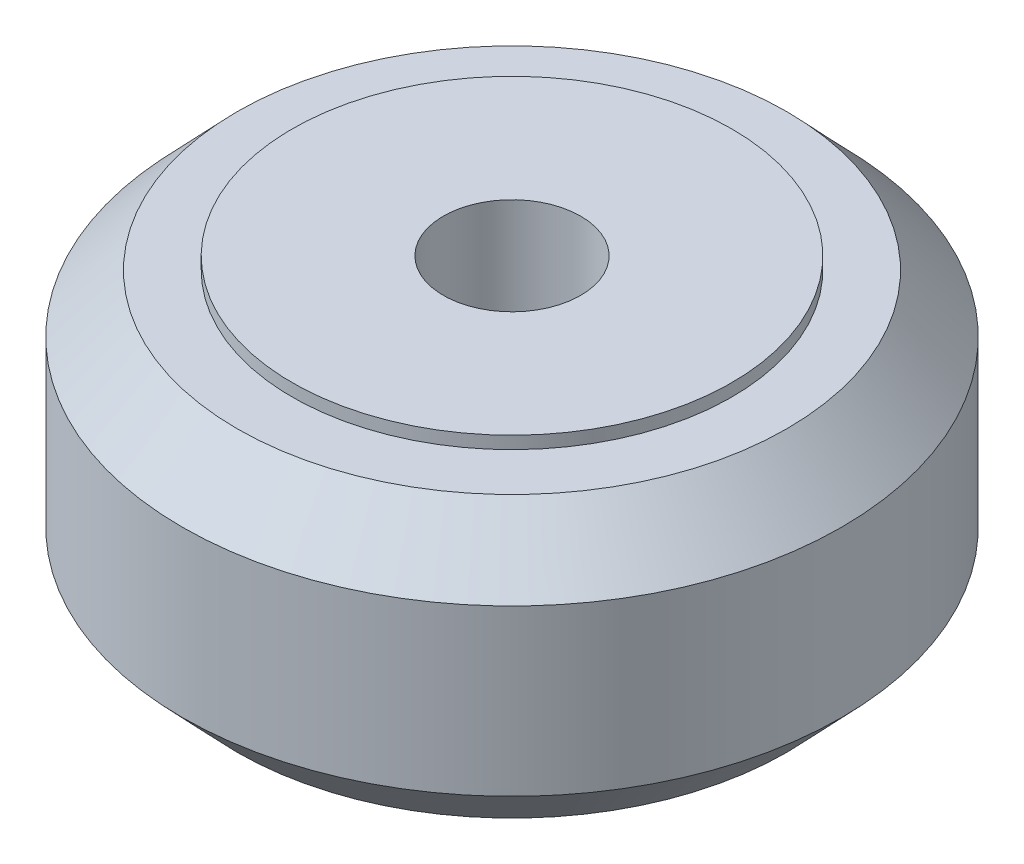
from build123d import *


with BuildPart() as part:
    # Sketch1 → Revolve1 (revolve)
    with BuildSketch(Plane.XY, mode=Mode.PRIVATE) as revolve1_sk:
        Polygon((2.5, -5.555), (2.5, 5.555), (8, 5.555), (8, 5.1), (10, 5.1), (12, 3), (12, -3), (10, -5.1), (8, -5.1), (8, -5.555), align=None)
    revolve(revolve1_sk.sketch.rotate(Axis((0, -55, 0), (0, 1, 0)), 90), axis=Axis((0, -55, 0), (0, 1, 0)))


solid = part.part
